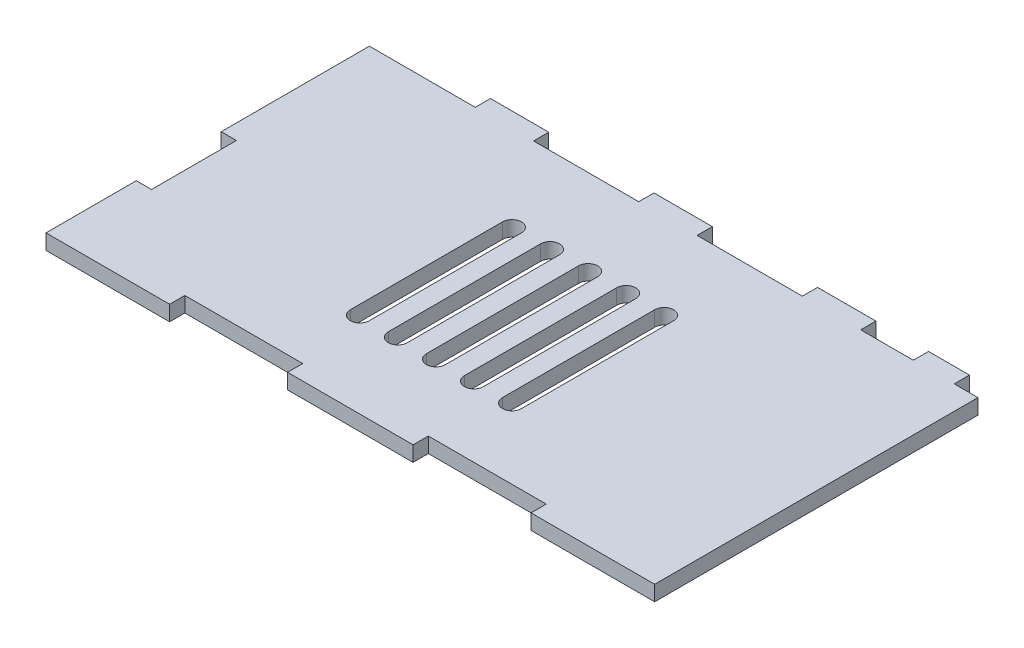
from build123d import *

# Parameters (mm, degrees)
SKETCH1_W           = 156
SKETCH1_H           = 85
BOSS_EXTRUDE1_DEPTH = 4
SKETCH2_W           = 15.33
SKETCH2_H           = 4
BOSS_EXTRUDE2_DEPTH = 4
SKETCH3_W           = 31
SKETCH3_H           = 4
CUT_EXTRUDE2_DEPTH  = 4
SKETCH4_W           = 4
SKETCH4_H           = 26.74
SKETCH4_H_2         = 28.24
BOSS_EXTRUDE3_DEPTH = 4
SKETCH5_W           = 10.75
SKETCH5_H           = 4
BOSS_EXTRUDE4_DEPTH = 4
CUT_EXTRUDE3_DEPTH  = 4
SKETCH7_W           = 4
SKETCH7_H           = 8.78
SKETCH7_H_2         = 1.92320958
BOSS_EXTRUDE5_DEPTH = 4
SKETCH8_W           = 4
SKETCH8_H           = 2.999936799
CUT_EXTRUDE4_DEPTH  = 4


with BuildPart() as part:
    # Sketch1 → Boss-Extrude1 (new body)
    with BuildSketch(Plane(origin=(0, 0, 0), x_dir=(1, 0, 0), z_dir=(0, 1, 0))):
        with Locations((78, 42.5)):
            Rectangle(SKETCH1_W, SKETCH1_H)
    extrude(amount=BOSS_EXTRUDE1_DEPTH)

    # Sketch2 → Boss-Extrude2 (add)
    with BuildSketch(Plane(origin=(0, 4, 0), x_dir=(1, 0, 0), z_dir=(0, 1, 0))):
        with Locations((31.495, 87)):
            Rectangle(SKETCH2_W, SKETCH2_H)
        with Locations((74.495, 87)):
            Rectangle(SKETCH2_W, SKETCH2_H)
        with Locations((117.495, 87)):
            Rectangle(SKETCH2_W, SKETCH2_H)
    extrude(amount=-BOSS_EXTRUDE2_DEPTH)

    # Sketch3 → Cut-Extrude2 (cut)
    with BuildSketch(Plane(origin=(0, 4, 0), x_dir=(1, 0, 0), z_dir=(0, 1, 0))):
        with Locations((44, 2)):
            Rectangle(SKETCH3_W, SKETCH3_H)
        with Locations((108, 2)):
            Rectangle(SKETCH3_W, SKETCH3_H)
    extrude(amount=-CUT_EXTRUDE2_DEPTH, mode=Mode.SUBTRACT)

    # Sketch4 → Boss-Extrude3 (add)
    with BuildSketch(Plane(origin=(0, 4, 0), x_dir=(1, 0, 0), z_dir=(0, 1, 0))):
        with Locations((-2, 13.37)):
            Rectangle(SKETCH4_W, SKETCH4_H)
        with Locations((-2, 62.1)):
            Rectangle(SKETCH4_W, SKETCH4_H_2)
    extrude(amount=-BOSS_EXTRUDE3_DEPTH)

    # Sketch5 → Boss-Extrude4 (add)
    with BuildSketch(Plane(origin=(0, 4, 0), x_dir=(1, 0, 0), z_dir=(0, 1, 0))):
        with Locations((144.375, 87)):
            Rectangle(SKETCH5_W, SKETCH5_H)
    extrude(amount=-BOSS_EXTRUDE4_DEPTH)

    # Sketch6 → Cut-Extrude3 (cut)
    with BuildSketch(Plane(origin=(0, 4, 0), x_dir=(1, 0, 0), z_dir=(0, 1, 0))):
        with BuildLine():
            Line((68.5, 22.5), (68.5, 62.5))
            ThreePointArc((68.5, 62.5), (66, 65), (63.5, 62.5))
            Line((63.5, 62.5), (63.5, 22.5))
            ThreePointArc((63.5, 22.5), (66, 20), (68.5, 22.5))
        make_face()
        with BuildLine():
            Line((58.5, 22.5), (58.5, 62.5))
            ThreePointArc((58.5, 62.5), (56, 65), (53.5, 62.5))
            Line((53.5, 62.5), (53.5, 22.5))
            ThreePointArc((53.5, 22.5), (56, 20), (58.5, 22.5))
        make_face()
        with BuildLine():
            Line((78.5, 22.5), (78.5, 62.5))
            ThreePointArc((78.5, 62.5), (76, 65), (73.5, 62.5))
            Line((73.5, 62.5), (73.5, 22.5))
            ThreePointArc((73.5, 22.5), (76, 20), (78.5, 22.5))
        make_face()
        with BuildLine():
            Line((88.5, 22.5), (88.5, 62.5))
            ThreePointArc((88.5, 62.5), (86, 65), (83.5, 62.5))
            Line((83.5, 62.5), (83.5, 22.5))
            ThreePointArc((83.5, 22.5), (86, 20), (88.5, 22.5))
        make_face()
        with BuildLine():
            Line((98.5, 22.5), (98.5, 62.5))
            ThreePointArc((98.5, 62.5), (96, 65), (93.5, 62.5))
            Line((93.5, 62.5), (93.5, 22.5))
            ThreePointArc((93.5, 22.5), (96, 20), (98.5, 22.5))
        make_face()
    extrude(amount=-CUT_EXTRUDE3_DEPTH, mode=Mode.SUBTRACT)

    # Sketch7 → Boss-Extrude5 (add)
    with BuildSketch(Plane(origin=(0, 4, 0), x_dir=(1, 0, 0), z_dir=(0, 1, 0))):
        with Locations((-2, 80.61)):
            Rectangle(SKETCH7_W, SKETCH7_H)
        with Locations((-2, 47.01839521)):
            Rectangle(SKETCH7_W, SKETCH7_H_2)
    extrude(amount=-BOSS_EXTRUDE5_DEPTH)

    # Sketch8 → Cut-Extrude4 (cut)
    with BuildSketch(Plane(origin=(0, 4, 0), x_dir=(1, 0, 0), z_dir=(0, 1, 0))):
        with Locations((-2, 25.240031601)):
            Rectangle(SKETCH8_W, SKETCH8_H)
    extrude(amount=-CUT_EXTRUDE4_DEPTH, mode=Mode.SUBTRACT)


solid = part.part
